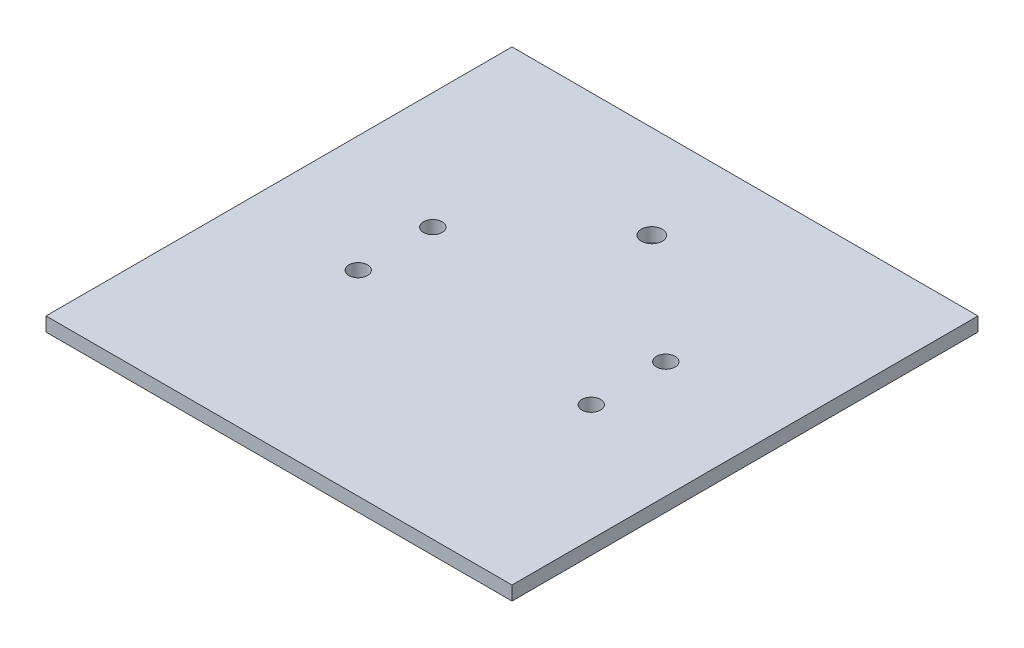
from build123d import *

# Parameters (mm, degrees)
SKETCH_1_W      = 200
SKETCH_1_H      = 200
SKETCH_1_R      = 4.5
SKETCH_1_R_2    = 4
EXTRUDE_1_DEPTH = 6


with BuildPart() as part:
    # 草图1 → 凸台-拉伸1 (new body)
    with BuildSketch(Plane(origin=(0, 0, 0), x_dir=(1, 0, 0), z_dir=(0, 1, 0))):
        Rectangle(SKETCH_1_W, SKETCH_1_H)
        with Locations(Location((0, 60, 0), (0, 0, 270))):
            Circle(SKETCH_1_R, mode=Mode.SUBTRACT)
        with Locations(Location((50, 16, 0), (0, 0, 270))):
            Circle(SKETCH_1_R_2, mode=Mode.SUBTRACT)
        with Locations(Location((50, -16, 0), (0, 0, 270))):
            Circle(SKETCH_1_R_2, mode=Mode.SUBTRACT)
        with Locations(Location((-50, -16, 0), (0, 0, 90))):
            Circle(SKETCH_1_R_2, mode=Mode.SUBTRACT)
        with Locations(Location((-50, 16, 0), (0, 0, 90))):
            Circle(SKETCH_1_R_2, mode=Mode.SUBTRACT)
    extrude(amount=EXTRUDE_1_DEPTH)


solid = part.part
